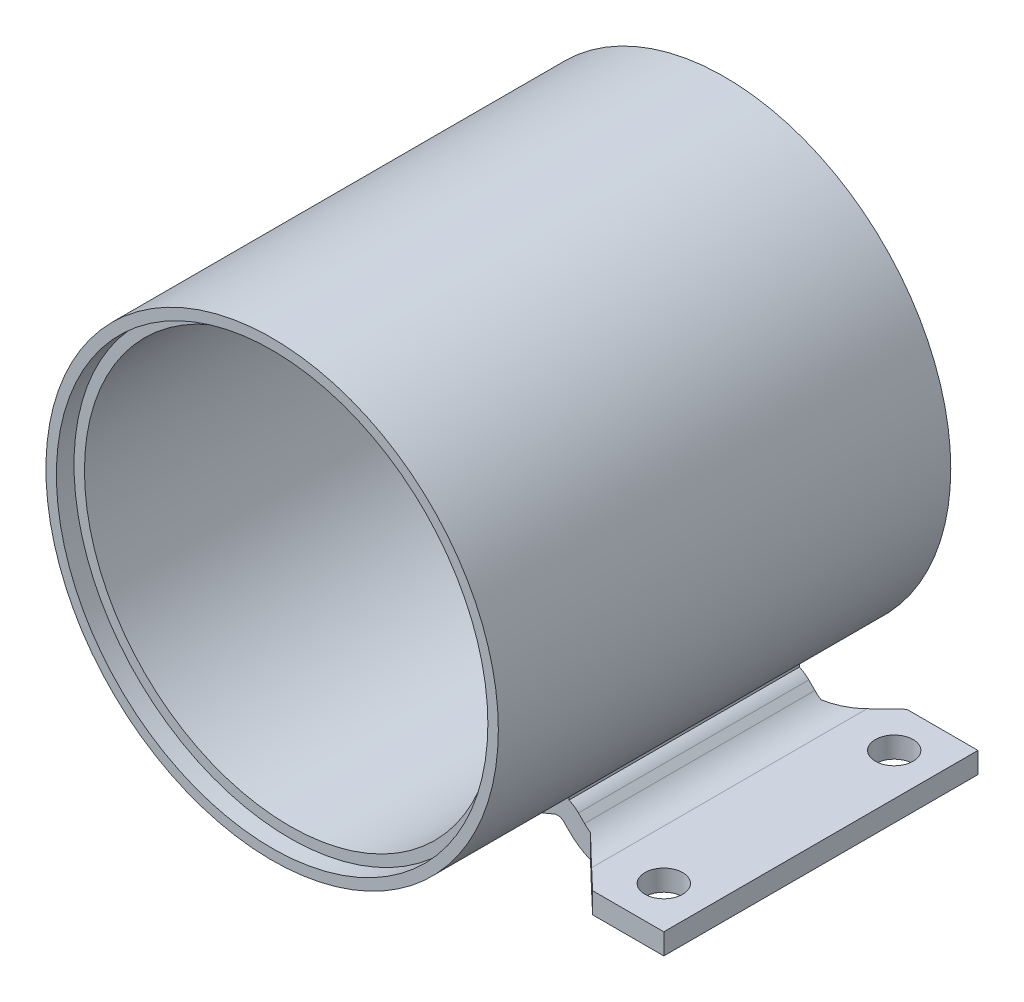
from build123d import *

# Parameters (mm, degrees)
ESQUISSE1_R                     = 54
ESQUISSE1_R_2                   = 49
EXTRUSION1_DEPTH                = 108
ESQUISSE2_R                     = 51.5
ENL_V_MAT_EXTRU_1_DEPTH         = 4.2
ENL_V_START                     = -4.2
ESQUISSE3_R                     = 51.5
ENL_V_MAT_EXTRU_2_DEPTH         = 4.2
ESQUISSE4_W                     = 13.403361345
ESQUISSE4_H                     = 3
ENL_V_MAT_EXTRU_3_DEPTH         = 4.2
EXTRUSION2_DEPTH                = 75
ENL_V_MAT_EXTRU_4_REACH         = 170.286
ENL_V_MAT_EXTRU_4_END_RADIUS    = 54
EXTRUSION3_DEPTH                = 55
R_P_TITION_LIN_AIRE1_COUNT      = 2
R_P_TITION_LIN_AIRE1_PITCH      = 55
R_P_TITION_LIN_AIRE1_COUNT_DIR2 = 2
R_P_TITION_LIN_AIRE1_PITCH_DIR2 = 101


with BuildPart() as part:
    # Esquisse1 → Extrusion1 (new body)
    with BuildSketch(Plane.XY):
        Circle(ESQUISSE1_R)
        Circle(ESQUISSE1_R_2, mode=Mode.SUBTRACT)
    extrude(amount=EXTRUSION1_DEPTH)

    # Esquisse2 → Enlèv. mat.-Extru.1 (cut)
    with BuildSketch(Plane.XY.offset(108)):
        Circle(ESQUISSE2_R)
    extrude(amount=-ENL_V_MAT_EXTRU_1_DEPTH, mode=Mode.SUBTRACT)

    # Esquisse3 → Enlèv. mat.-Extru.2 (cut)
    with BuildSketch(Plane(origin=(0, 0, 0), x_dir=(-1, 0, 0), z_dir=(0, 0, -1)).offset(ENL_V_START)):
        with Locations(Location((0, 0, 0), (0, 0, 180))):
            Circle(ESQUISSE3_R)
    extrude(amount=ENL_V_MAT_EXTRU_2_DEPTH, mode=Mode.SUBTRACT)

    # Esquisse4 → Enlèv. mat.-Extru.3 (cut)
    with BuildSketch(Plane(origin=(0, 0, 0), x_dir=(-1, 0, 0), z_dir=(0, 0, -1))):
        with Locations((51.37955182, 0)):
            Rectangle(ESQUISSE4_W, ESQUISSE4_H)
    extrude(amount=-ENL_V_MAT_EXTRU_3_DEPTH, mode=Mode.SUBTRACT)

    # Esquisse5 → Extrusion2 (add)
    with BuildSketch(Plane(origin=(0, 0, 0), x_dir=(-1, 0, 0), z_dir=(0, 0, -1))):
        with BuildLine():
            Line((-60.5, -60), (-38.642135624, -60))
            ThreePointArc((-38.642135624, -60), (-32.901884138, -58.858192988), (-28.035533906, -55.606601718))
            Line((-28.035533906, -55.606601718), (-26.581131511, -54.152199323))
            ThreePointArc((-26.581131511, -54.152199323), (-25.525097055, -53.598747333), (-24.341773098, -53.744563283))
            ThreePointArc((-24.341773098, -53.744563283), (0, -59), (24.341773098, -53.744563283))
            ThreePointArc((24.341773098, -53.744563283), (25.525097055, -53.598747333), (26.581131511, -54.152199323))
            Line((26.581131511, -54.152199323), (28.035533906, -55.606601718))
            ThreePointArc((28.035533906, -55.606601718), (32.901884138, -58.858192988), (38.642135624, -60))
            Line((38.642135624, -60), (60.5, -60))
            Line((60.5, -60), (60.5, -55))
            Line((60.5, -55), (38.642135624, -55))
            ThreePointArc((38.642135624, -55), (34.8153013, -54.238795325), (31.571067812, -52.071067812))
            Line((31.571067812, -52.071067812), (30.116665417, -50.616665417))
            ThreePointArc((30.116665417, -50.616665417), (26.42054482, -48.67958345), (22.278910971, -49.189939276))
            ThreePointArc((22.278910971, -49.189939276), (0, -54), (-22.278910971, -49.189939276))
            ThreePointArc((-22.278910971, -49.189939276), (-26.42054482, -48.67958345), (-30.116665417, -50.616665417))
            Line((-30.116665417, -50.616665417), (-31.571067812, -52.071067812))
            ThreePointArc((-31.571067812, -52.071067812), (-34.8153013, -54.238795325), (-38.642135624, -55))
            Line((-38.642135624, -55), (-60.5, -55))
            Line((-60.5, -55), (-60.5, -60))
        make_face()
    extrude(amount=-EXTRUSION2_DEPTH)

    # Enlèv. mat.-Extru.4: up to this cylinder (the profile starts outside it)
    enl_v_mat_extru_4_end = Plane(origin=(0, 0, 37.5), z_dir=(0, 0, -1)) * Cylinder(ENL_V_MAT_EXTRU_4_END_RADIUS, 515.029516, mode=Mode.PRIVATE)
    # Esquisse6 → Enlèv. mat.-Extru.4 (cut, up to the surface)
    with BuildSketch(Plane.XZ.offset(60), mode=Mode.PRIVATE) as enl_v_mat_extru_4_sk1:
        Polygon((43.5, 0), (-43.5, 0), (-33, 10), (33, 10), align=None)
    enl_v_mat_extru_4_tool1 = extrude(enl_v_mat_extru_4_sk1.sketch, amount=-ENL_V_MAT_EXTRU_4_REACH, mode=Mode.PRIVATE) - enl_v_mat_extru_4_end
    add(enl_v_mat_extru_4_tool1.solids().sort_by_distance((0, -60, 4.771242))[0], mode=Mode.SUBTRACT)
    # Esquisse6 → Enlèv. mat.-Extru.4 (cut, up to the surface)
    with BuildSketch(Plane.XZ.offset(60), mode=Mode.PRIVATE) as enl_v_mat_extru_4_sk2:
        Polygon((-33, 65), (-43.5, 75), (43.5, 75), (33, 65), align=None)
    enl_v_mat_extru_4_tool2 = extrude(enl_v_mat_extru_4_sk2.sketch, amount=-ENL_V_MAT_EXTRU_4_REACH, mode=Mode.PRIVATE) - enl_v_mat_extru_4_end
    add(enl_v_mat_extru_4_tool2.solids().sort_by_distance((0, -60, 70.228758))[0], mode=Mode.SUBTRACT)

    # Esquisse7 → Extrusion3 (add)
    with BuildSketch(Plane(origin=(0, 0, 10), x_dir=(-1, 0, 0), z_dir=(0, 0, -1))):
        with BuildLine():
            Line((27.857974208, -46.259412804), (27.857974208, -49.104353136))
            ThreePointArc((27.857974208, -49.104353136), (25.059546429, -48.567236408), (22.278910971, -49.189939276))
            ThreePointArc((22.278910971, -49.189939276), (25.111228768, -47.806131299), (27.857974208, -46.259412804))
        make_face()
        with BuildLine():
            Line((-27.857974208, -46.259412804), (-27.857974208, -49.104353136))
            ThreePointArc((-27.857974208, -49.104353136), (-25.059546429, -48.567236408), (-22.278910971, -49.189939276))
            ThreePointArc((-22.278910971, -49.189939276), (-25.111228768, -47.806131299), (-27.857974208, -46.259412804))
        make_face()
    extrude(amount=-EXTRUSION3_DEPTH)

    # Esquisse10 → Dégagement M81 (revolve, cut)
    with BuildSketch(Plane(origin=(50.5, -55, 10), x_dir=(0, 0, 1), z_dir=(1, 0, 0))):
        Polygon((0, 0), (0, 26.703872786), (4.5, 24), (4.5, 0), align=None)
    d_gagement_m81 = revolve(axis=Axis((50.5, -48.65, 10), (0, -1, 0)), mode=Mode.SUBTRACT)

    # Répétition linéaire1: D_gagement M81 2 × 2
    with Locations(*[(-j * R_P_TITION_LIN_AIRE1_PITCH_DIR2, 0, i * R_P_TITION_LIN_AIRE1_PITCH) for i in range(R_P_TITION_LIN_AIRE1_COUNT) for j in range(R_P_TITION_LIN_AIRE1_COUNT_DIR2) if (i, j) != (0, 0)]):
        add(d_gagement_m81, mode=Mode.SUBTRACT)


solid = part.part
